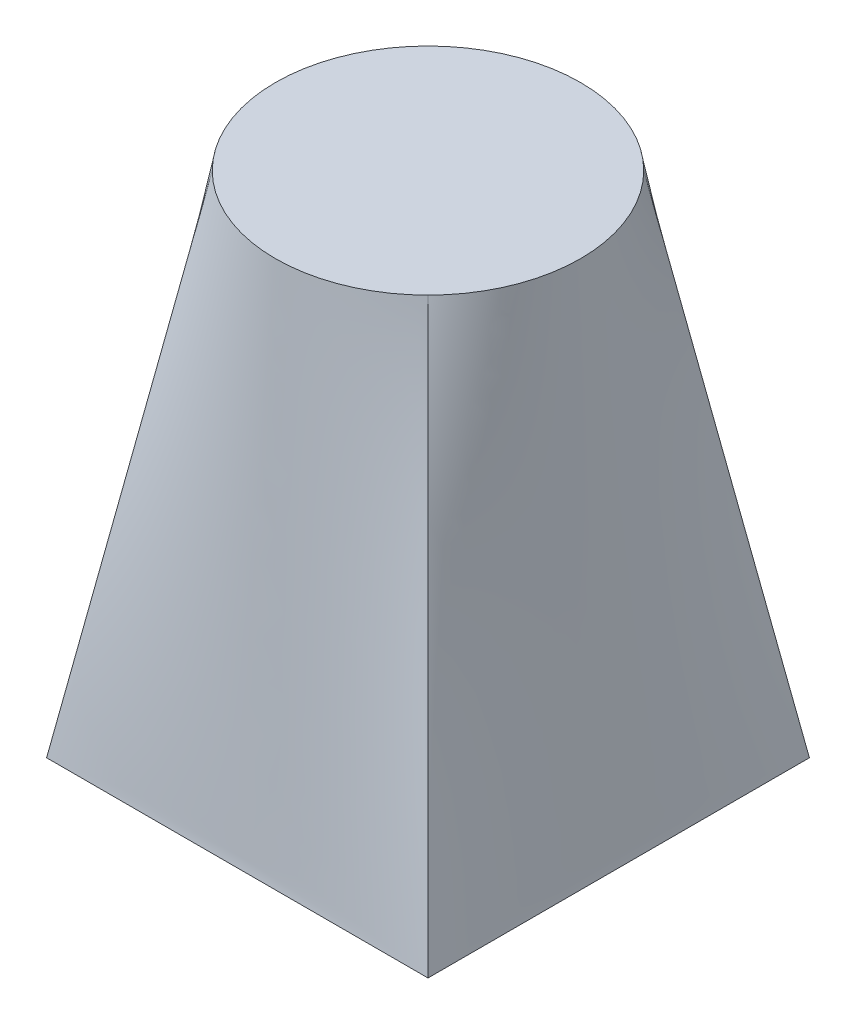
from build123d import *


with BuildPart() as part:
    # 草图1 → 放样1 section 0
    with BuildSketch(Plane(origin=(0, 0, 0), x_dir=(1, 0, 0), z_dir=(0, 1, 0))):
        with BuildLine():
            Line((-15, 15), (15, 15))
            Line((15, 15), (15, -15))
            Line((15, -15), (-15, -15))
            Line((-15, -15), (-15, 15))
        make_face()
    # 草图2 for 放样1 → 放样1 section 1
    with BuildSketch(Plane(origin=(0, 40, 0), x_dir=(1, 0, 0), z_dir=(0, 1, 0))):
        with BuildLine():
            # circular arc as an exact rational Bezier (weights 1, cos(half-angle), 1)
            Bezier((-8.485281374, 8.485281374), (0, 16.970562749), (8.485281374, 8.485281374), weights=[1, 0.707106781, 1])
            Bezier((8.485281374, 8.485281374), (16.970562749, 0), (8.485281374, -8.485281374), weights=[1, 0.707106781, 1])
            Bezier((8.485281374, -8.485281374), (0, -16.970562749), (-8.485281374, -8.485281374), weights=[1, 0.707106781, 1])
            Bezier((-8.485281374, -8.485281374), (-16.970562749, 0), (-8.485281374, 8.485281374), weights=[1, 0.707106781, 1])
        make_face()
    loft()


solid = part.part
